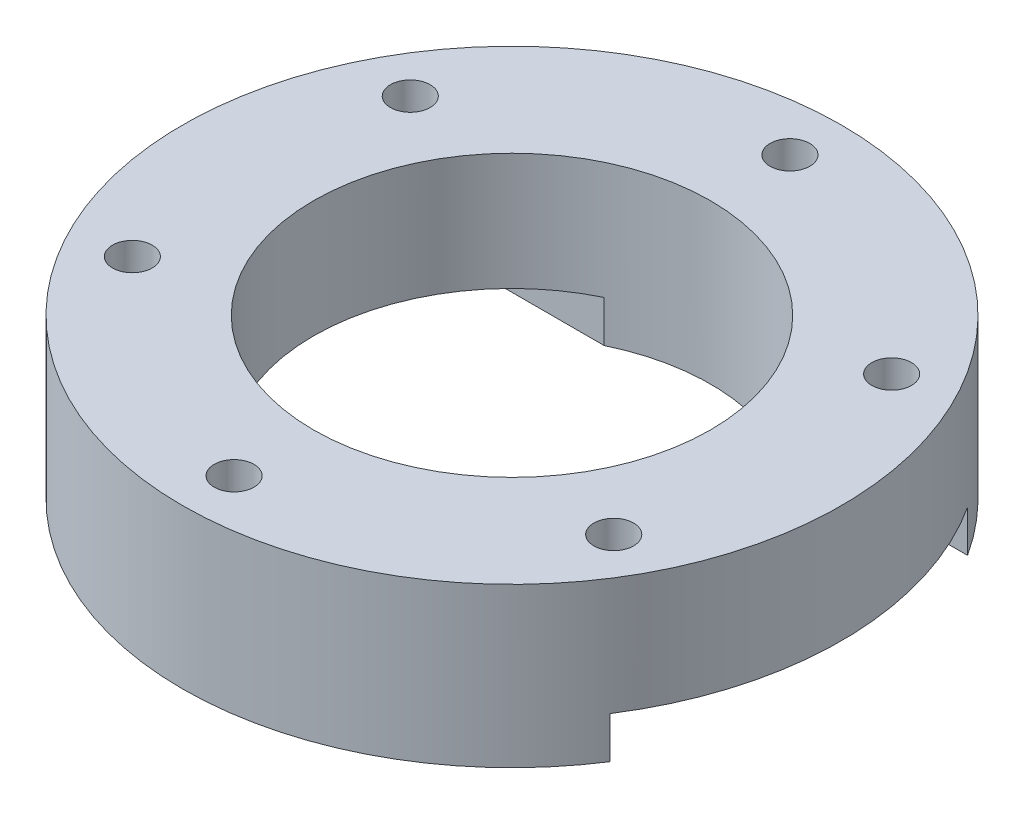
from build123d import *

# Parameters (mm, degrees)
SKETCH1_R          = 41.5
MAIN_PLATE_DEPTH   = 20
SKETCH3_R          = 2.5
SKETCH3_R_2        = 25
MOMO_SPARKO_DEPTH  = 63.004032127
SKETCH4_W          = 90
SKETCH4_H          = 45
CUT_EXTRUDE1_DEPTH = 5.25


with BuildPart() as part:
    # Sketch1 → Main Plate (new body)
    with BuildSketch(Plane(origin=(0, 0, 0), x_dir=(1, 0, 0), z_dir=(0, 1, 0))):
        with Locations(Location((0, 0, 0), (0, 0, 270))):
            Circle(SKETCH1_R)
    extrude(amount=MAIN_PLATE_DEPTH)

    # Sketch3 → Momo - Sparko (cut, through all)
    with BuildSketch(Plane(origin=(0, 20, 0), x_dir=(1, 0, 0), z_dir=(0, 1, 0))):
        with Locations(Location((0, 35, 0), (0, 0, 270))):
            Circle(SKETCH3_R)
        with Locations(Location((0, 0, 0), (0, 0, 270))):
            Circle(SKETCH3_R_2)
        with Locations(Location((30.310889132, 17.5, 0), (0, 0, 270))):
            Circle(SKETCH3_R)
        with Locations(Location((30.310889132, -17.5, 0), (0, 0, 270))):
            Circle(SKETCH3_R)
        with Locations(Location((0, -35, 0), (0, 0, 270))):
            Circle(SKETCH3_R)
        with Locations(Location((-30.310889132, -17.5, 0), (0, 0, 270))):
            Circle(SKETCH3_R)
        with Locations(Location((-30.310889132, 17.5, 0), (0, 0, 270))):
            Circle(SKETCH3_R)
    extrude(amount=-MOMO_SPARKO_DEPTH, mode=Mode.SUBTRACT)

    # Sketch4 → Cut-Extrude1 (cut)
    with BuildSketch(Plane.XZ):
        Rectangle(SKETCH4_W, SKETCH4_H)
    extrude(amount=-CUT_EXTRUDE1_DEPTH, mode=Mode.SUBTRACT)


solid = part.part
